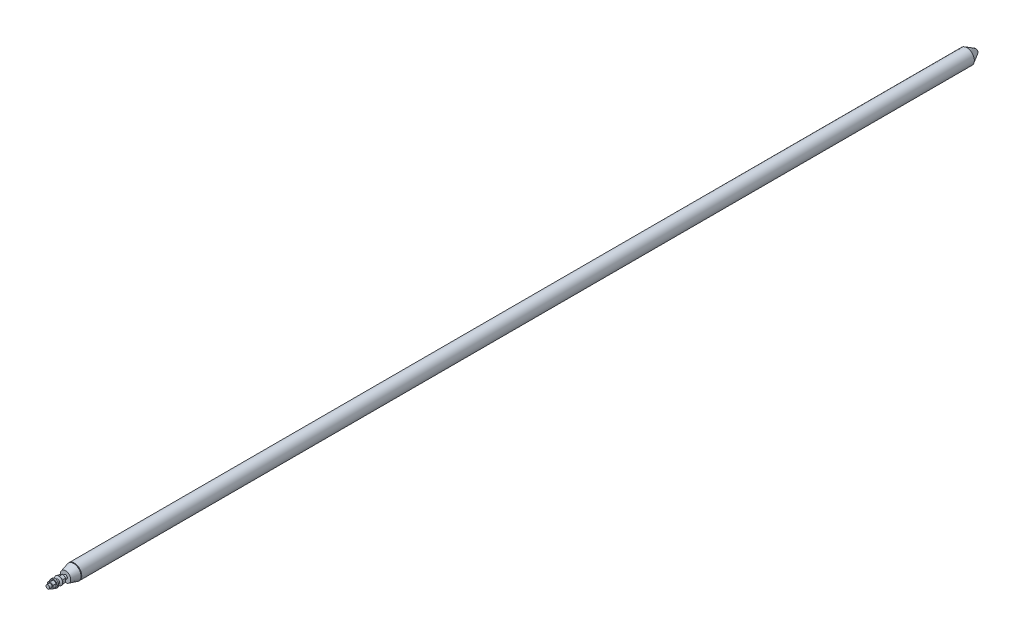
from build123d import *

# Parameters (mm, degrees)
BOSS_EXTRUDE1_DEPTH = 15.478125
SKETCH5_W           = 5.8166
SKETCH5_H           = 16.6751
BOSS_EXTRUDE2_DEPTH = 13.890625


with BuildPart() as part:
    # Sketch1 → Base-Revolve (revolve)
    with BuildSketch(Plane(origin=(0, 0, 0), x_dir=(0, 0, -1), z_dir=(1, 0, 0))):
        Polygon((-76.2, 0), (-76.2, 7.9375), (0, 7.9375), (0, 22.225), (34.895210283, 31.75), (38.1, 28.575), (47.625, 28.575), (47.625, 0), align=None)
    revolve(axis=Axis((0, 0, 0), (0, 0, 1)))

    # Sketch3 → Boss-Revolve2 (revolve)
    with BuildSketch(Plane(origin=(0, 0, 0), x_dir=(0, 0, -1), z_dir=(1, 0, 0))):
        with BuildLine():
            Line((-28.1686, 0), (-28.1686, 17.4625))
            Line((-28.1686, 17.4625), (-29.7688, 17.4625))
            ThreePointArc((-29.7688, 17.4625), (-33.309963658, 9.048473715), (-34.5186, 0))
            Line((-34.5186, 0), (-28.1686, 0))
        make_face()
    revolve(axis=Axis((0, 0, 0), (0, 0, 1)))

    # Sketch2 → Boss-Revolve1 (revolve)
    with BuildSketch(Plane(origin=(0, 0, 0), x_dir=(0, 0, -1), z_dir=(1, 0, 0))):
        with BuildLine():
            Line((38.1, 31.75), (38.1, 28.5623))
            Line((38.1, 28.5623), (3880.040929955, 28.5623))
            Line((3880.040929955, 28.5623), (3880.040929955, 0))
            Line((3880.040929955, 0), (3922.333543095, 0))
            ThreePointArc((3922.333543095, 0), (3920.632065723, 6.35), (3915.983543095, 10.998522628))
            Line((3915.983543095, 10.998522628), (3880.040929955, 31.75))
            Line((3880.040929955, 31.75), (38.1, 31.75))
        make_face()
    revolve(axis=Axis((0, 0, 29.7434), (0, 0, -1)))

    # Sketch4 → Boss-Extrude1 (add)
    with BuildSketch(Plane(origin=(0, 0, 28.1686), x_dir=(-1, 0, 0), z_dir=(0, 0, -1))):
        Polygon((0, -15.588572738), (13.5001, -7.794286369), (13.5001, 7.794286369), (0, 15.588572738), (-13.5001, 7.794286369), (-13.5001, -7.794286369), align=None)
    extrude(amount=BOSS_EXTRUDE1_DEPTH)

    # Sketch5 → Boss-Revolve3 (revolve)
    with BuildSketch(Plane(origin=(0, 0, 0), x_dir=(0, 0, -1), z_dir=(1, 0, 0))):
        with Locations((-49.200698399, 8.33755)):
            Rectangle(SKETCH5_W, SKETCH5_H)
    revolve(axis=Axis((0, 0, 0), (0, 0, 1)))

    # Sketch6 → Boss-Extrude2 (add)
    with BuildSketch(Plane.XY.offset(52.108998399)):
        Polygon((0, -13.755485633), (11.9126, -6.877742817), (11.9126, 6.877742817), (0, 13.755485633), (-11.9126, 6.877742817), (-11.9126, -6.877742817), align=None)
    extrude(amount=BOSS_EXTRUDE2_DEPTH)


solid = part.part
